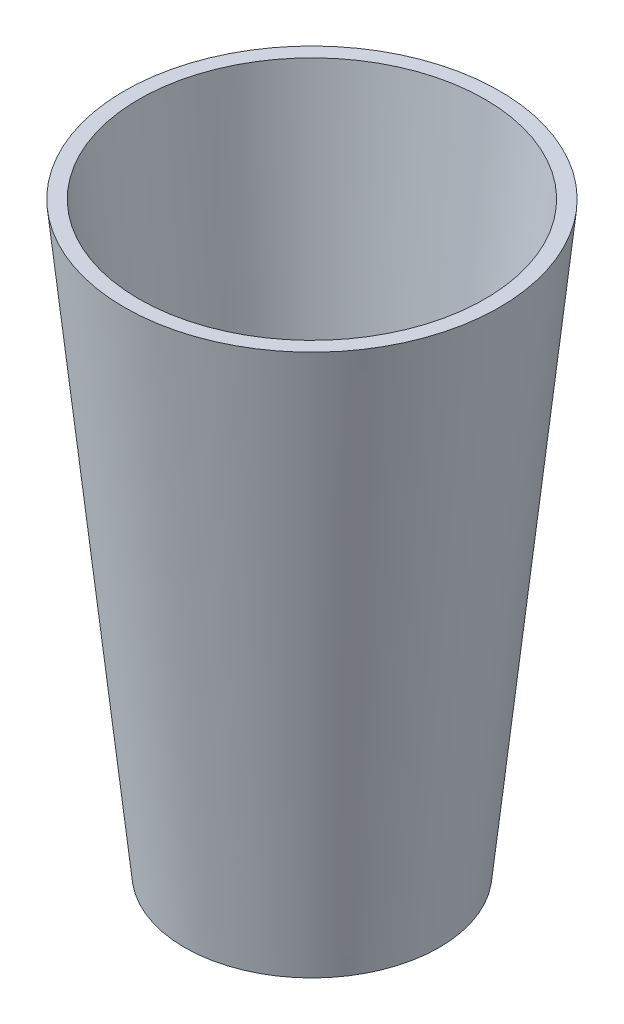
from build123d import *

# Parameters (mm, degrees)
COQUE4_T = -2


with BuildPart() as part:
    # Esquisse1 → Révolution1 (revolve)
    with BuildSketch(Plane.XY, mode=Mode.PRIVATE) as r_volution1_sk:
        Polygon((0, -41.802998847), (17.631196792, -41.802998847), (25.972838286, 39.14884019), (0, 39.14884019), align=None)
    revolve(r_volution1_sk.sketch.rotate(Axis((0, 50.14464034, 0), (0, -1, 0)), 90), axis=Axis((0, 50.14464034, 0), (0, -1, 0)))

    # Coque4
    coque4_openings = [part.faces().sort_by_distance(p)[0] for p in [
        (0, 39.14884019, 0),
    ]]
    offset(amount=COQUE4_T, openings=coque4_openings, kind=Kind.INTERSECTION)


solid = part.part
